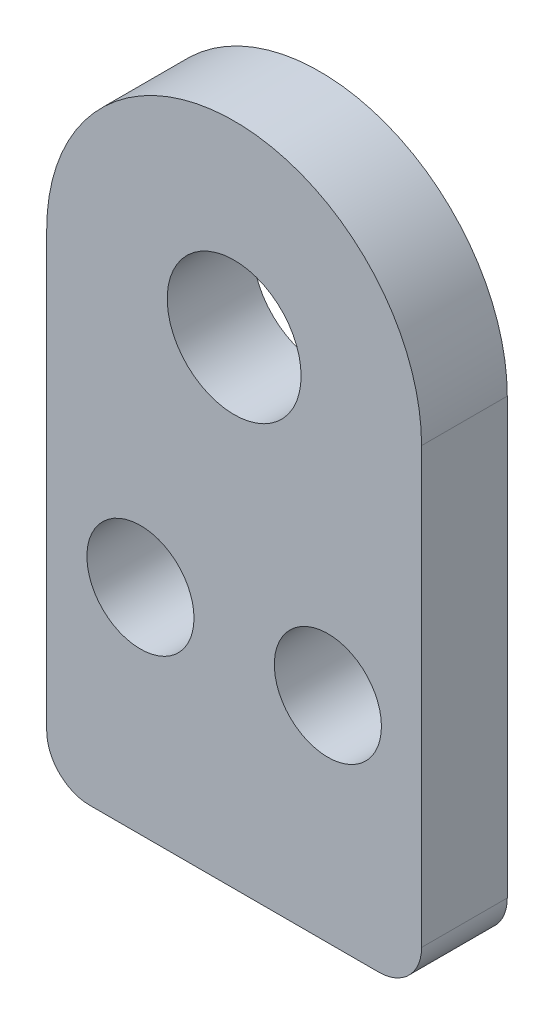
from build123d import *

# Parameters (mm, degrees)
SKETCH1_R           = 3.96875
SKETCH1_R_2         = 3.175
BOSS_EXTRUDE1_DEPTH = 5.08
FILLET1_R           = 2.54


with BuildPart() as part:
    # Sketch1 → Boss-Extrude1 (new body)
    with BuildSketch(Plane.XY):
        with BuildLine():
            Line((-11.1125, 15.6083), (-11.1125, 12.7))
            Line((-11.1125, 12.7), (-11.1125, -12.7))
            Line((-11.1125, -12.7), (11.1125, -12.7))
            Line((11.1125, -12.7), (11.1125, 12.7))
            Line((11.1125, 12.7), (11.1125, 15.6083))
            ThreePointArc((11.1125, 15.6083), (0, 26.7208), (-11.1125, 15.6083))
        make_face()
        with Locations((0, 15.6083)):
            Circle(SKETCH1_R, mode=Mode.SUBTRACT)
        with Locations((-5.55625, 0)):
            Circle(SKETCH1_R_2, mode=Mode.SUBTRACT)
        with Locations((5.55625, 0)):
            Circle(SKETCH1_R_2, mode=Mode.SUBTRACT)
    extrude(amount=BOSS_EXTRUDE1_DEPTH)

    # Fillet1
    fillet1_edges = [part.edges().sort_by_distance(p)[0] for p in [
        (11.1125, -12.7, 2.54),
        (-11.1125, -12.7, 2.54),
    ]]
    fillet(fillet1_edges, radius=FILLET1_R)


solid = part.part
